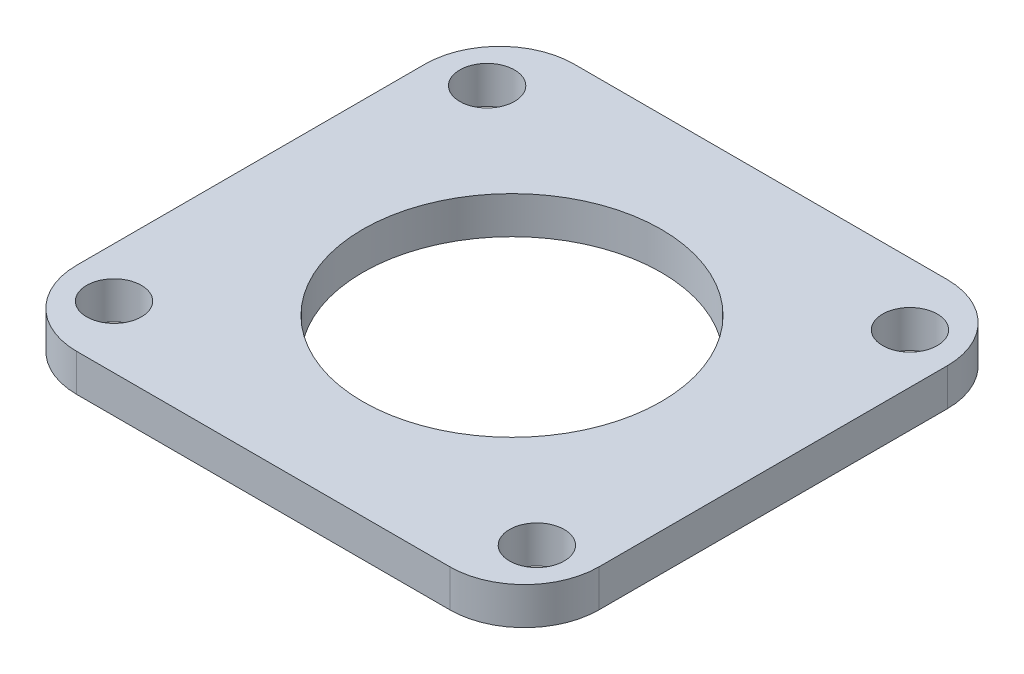
from build123d import *

# Parameters (mm, degrees)
SKETCH1_W           = 21
SKETCH1_H           = 20
SKETCH1_R           = 1.1
SKETCH1_R_2         = 6
BOSS_EXTRUDE1_DEPTH = 1.5
FILLET1_R           = 3


with BuildPart() as part:
    # Sketch1 → Boss-Extrude1 (new body)
    with BuildSketch(Plane(origin=(0, 0, 0), x_dir=(1, 0, 0), z_dir=(0, 1, 0))):
        Rectangle(SKETCH1_W, SKETCH1_H)
        with Locations(Location((8.5, 7.5, 0), (0, 0, 270))):
            Circle(SKETCH1_R, mode=Mode.SUBTRACT)
        with Locations(Location((-8.5, 7.5, 0), (0, 0, 270))):
            Circle(SKETCH1_R, mode=Mode.SUBTRACT)
        with Locations(Location((-8.5, -7.5, 0), (0, 0, 270))):
            Circle(SKETCH1_R, mode=Mode.SUBTRACT)
        with Locations(Location((8.5, -7.5, 0), (0, 0, 270))):
            Circle(SKETCH1_R, mode=Mode.SUBTRACT)
        with Locations(Location((0, 0, 0), (0, 0, 270))):
            Circle(SKETCH1_R_2, mode=Mode.SUBTRACT)
    extrude(amount=BOSS_EXTRUDE1_DEPTH)

    # Fillet1
    fillet1_edges = [part.edges().sort_by_distance(p)[0] for p in [
        (10.5, 0.75, 10),
        (-10.5, 0.75, 10),
        (-10.5, 0.75, -10),
        (10.5, 0.75, -10),
    ]]
    fillet(fillet1_edges, radius=FILLET1_R)


solid = part.part
